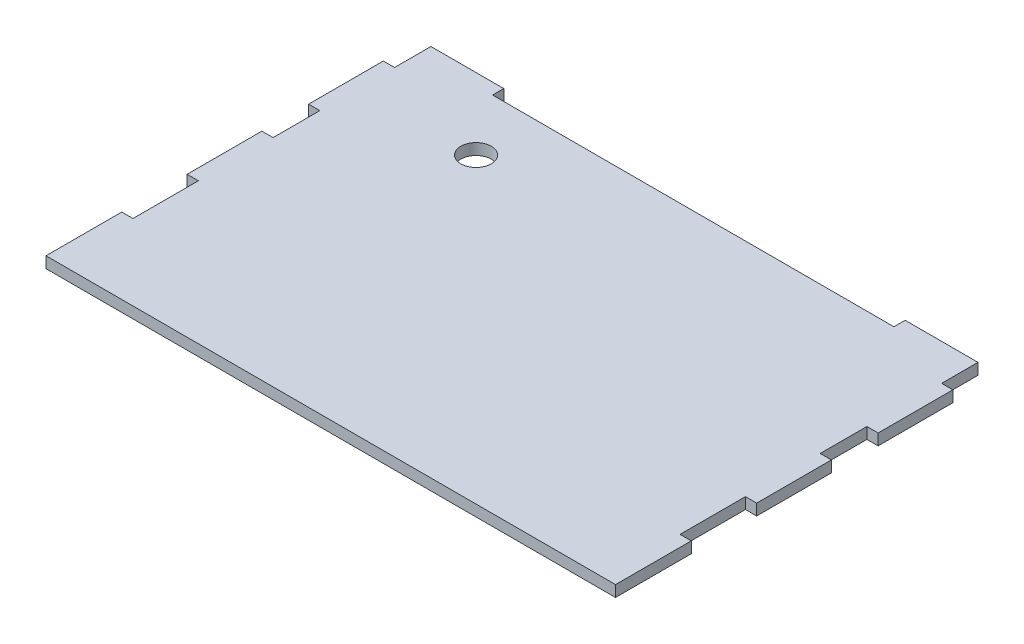
from build123d import *

# Parameters (mm, degrees)
BOSS_EXTRUDE1_DEPTH = 6
SKETCH2_R           = 8.15711865
CUT_EXTRUDE1_DEPTH  = 10


with BuildPart() as part:
    # Sketch1 → Boss-Extrude1 (new body)
    with BuildSketch(Plane(origin=(0, 0, 0), x_dir=(-1, 0, 0), z_dir=(0, 1, 0))):
        Polygon((-79.827586207, -104.482758621), (-79.827586207, -98.482758621), (134.972413793, -98.482758621), (134.972413793, -104.482758621), (173.972413793, -104.482758621), (173.972413793, -85.022758621), (179.972413793, -85.022758621), (179.972413793, -45.022758621), (173.972413793, -45.022758621), (173.972413793, -20.022758621), (179.972413793, -20.022758621), (179.972413793, 19.977241379), (173.972413793, 19.977241379), (173.972413793, 54.977241379), (179.972413793, 54.977241379), (179.972413793, 95.517241379), (-124.827586207, 95.517241379), (-124.827586207, 54.977241379), (-118.827586207, 54.977241379), (-118.827586207, 19.977241379), (-124.827586207, 19.977241379), (-124.827586207, -20.022758621), (-118.827586207, -20.022758621), (-118.827586207, -45.022758621), (-124.827586207, -45.022758621), (-124.827586207, -85.022758621), (-118.827586207, -85.022758621), (-118.827586207, -104.482758621), align=None)
    extrude(amount=BOSS_EXTRUDE1_DEPTH)

    # Sketch2 → Cut-Extrude1 (cut)
    with BuildSketch(Plane.XZ):
        with Locations(Location((-111.585458186, -66.257055968, 0), (0, 0, 270))):
            Circle(SKETCH2_R)
    extrude(amount=-CUT_EXTRUDE1_DEPTH, mode=Mode.SUBTRACT)


solid = part.part
